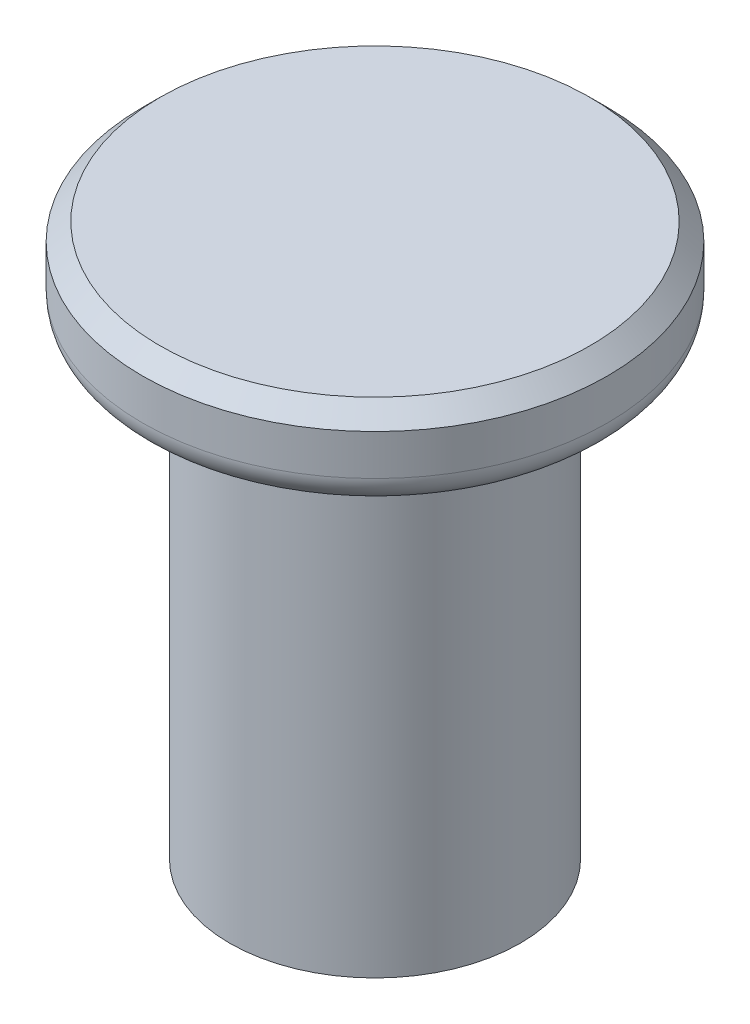
from build123d import *

# Parameters (mm, degrees)
CHAMFER_1_SIZE = 0.3
FILLET_1_R     = 0.5


with BuildPart() as part:
    # 草图2 → 旋转1 (revolve)
    with BuildSketch(Plane.XY):
        Polygon((0, -23.262759575), (4, -23.262759575), (4, -24.762759575), (2.5, -24.762759575), (2.5, -32.762759575), (0, -32.762759575), align=None)
    revolve(axis=Axis((0, -1000, 0), (0, 1, 0)))

    # 倒角1
    chamfer_1_edges = [part.edges().sort_by_distance(p)[0] for p in [
        (-4, -23.262759575, 0),
    ]]
    chamfer(chamfer_1_edges, length=CHAMFER_1_SIZE)

    # 圆角1
    fillet_1_edges = [part.edges().sort_by_distance(p)[0] for p in [
        (-4, -24.762759575, 0),
    ]]
    fillet(fillet_1_edges, radius=FILLET_1_R)


solid = part.part
